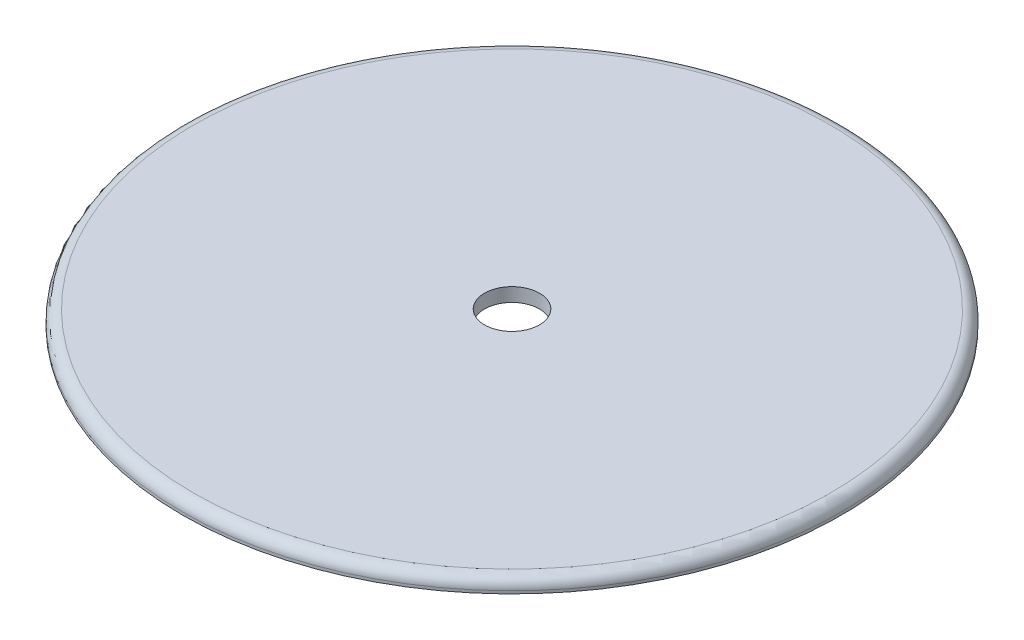
from build123d import *

# Parameters (mm, degrees)
SKETCH1_R           = 38.1
BOSS_EXTRUDE1_DEPTH = 1.5875
FILLET1_R           = 1.27
SKETCH2_R           = 3.175
CUT_EXTRUDE1_DEPTH  = 54.904917737


with BuildPart() as part:
    # Sketch1 → Boss-Extrude1 (new body)
    with BuildSketch(Plane(origin=(0, 0, 0), x_dir=(1, 0, 0), z_dir=(0, 1, 0))):
        with Locations(Location((0, 0, 0), (0, 0, 270))):
            Circle(SKETCH1_R)
    extrude(amount=BOSS_EXTRUDE1_DEPTH)

    # Fillet1
    fillet1_edges = [part.edges().sort_by_distance(p)[0] for p in [
        (0, 1.5875, -38.1),
    ]]
    fillet(fillet1_edges, radius=FILLET1_R)

    # Sketch2 → Cut-Extrude1 (cut, through all)
    with BuildSketch(Plane.XZ):
        with Locations(Location((0, 0, 0), (0, 0, 270))):
            Circle(SKETCH2_R)
    extrude(amount=-CUT_EXTRUDE1_DEPTH, mode=Mode.SUBTRACT)


solid = part.part
